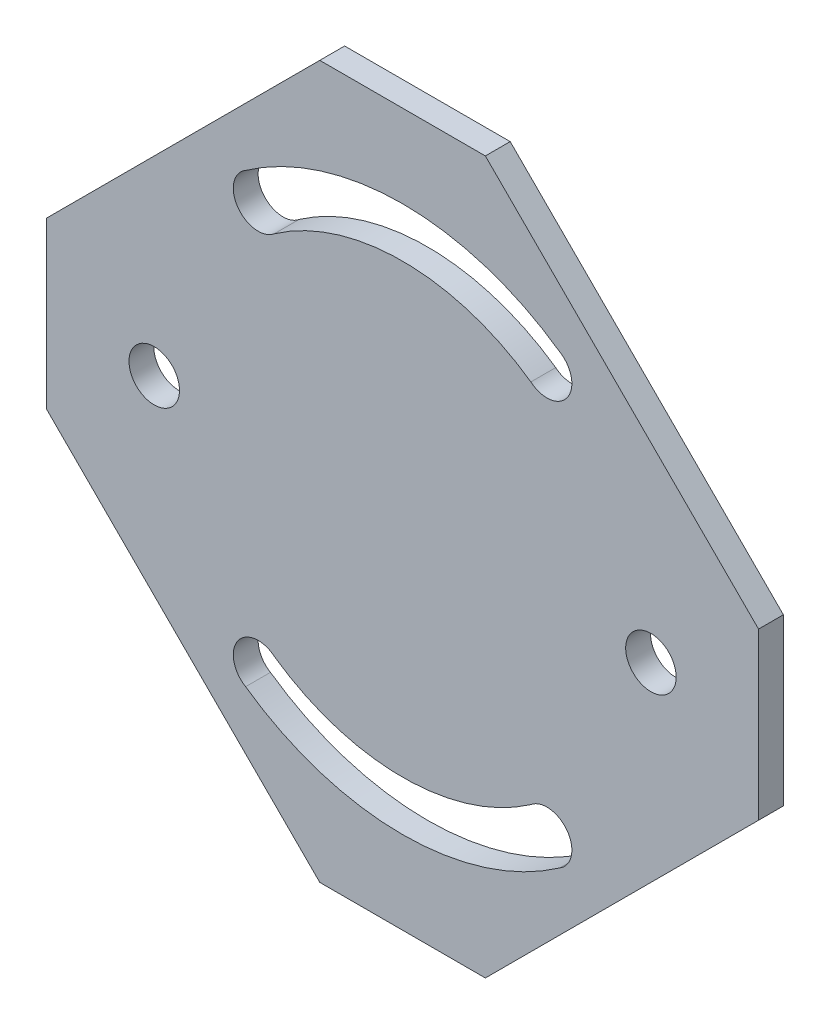
from build123d import *

# Parameters (mm, degrees)
SKETCH_1_R      = 3.0499512
EXTRUDE_1_DEPTH = 3


with BuildPart() as part:
    # 草图1 → 凸台-拉伸1 (new body)
    with BuildSketch(Plane.XY):
        Polygon((43.039042287, -10.445300798), (43.039042287, 9.554379202), (10.039570287, 42.553851202), (-9.960109713, 42.553851202), (-42.959581713, 9.554379202), (-42.959581713, -10.445300798), (-9.960109713, -43.444772798), (10.039570287, -43.444772798), align=None)
        with Locations((30.039250287, -0.445460798)):
            Circle(SKETCH_1_R, mode=Mode.SUBTRACT)
        with Locations((-29.959789713, -0.445460798)):
            Circle(SKETCH_1_R, mode=Mode.SUBTRACT)
        with BuildLine():
            ThreePointArc((15.536857472, 21.66371651), (0.039730287, 26.554107202), (-15.457396897, 21.66371651))
            ThreePointArc((-15.457396897, 21.66371651), (-19.856993747, 22.224541332), (-18.924411805, 26.56058421))
            ThreePointArc((-18.924411805, 26.56058421), (0.039730287, 32.554011202), (19.00387238, 26.56058421))
            ThreePointArc((19.00387238, 26.56058421), (19.936454322, 22.224541332), (15.536857472, 21.66371651))
        make_face(mode=Mode.SUBTRACT)
        with BuildLine():
            ThreePointArc((-15.457396897, -22.554638105), (0.039730287, -27.445028798), (15.536857472, -22.554638105))
            ThreePointArc((15.536857472, -22.554638105), (19.936454322, -23.115462927), (19.00387238, -27.451505806))
            ThreePointArc((19.00387238, -27.451505806), (0.039730287, -33.444932798), (-18.924411805, -27.451505806))
            ThreePointArc((-18.924411805, -27.451505806), (-19.856993747, -23.115462927), (-15.457396897, -22.554638105))
        make_face(mode=Mode.SUBTRACT)
    extrude(amount=EXTRUDE_1_DEPTH)


solid = part.part
